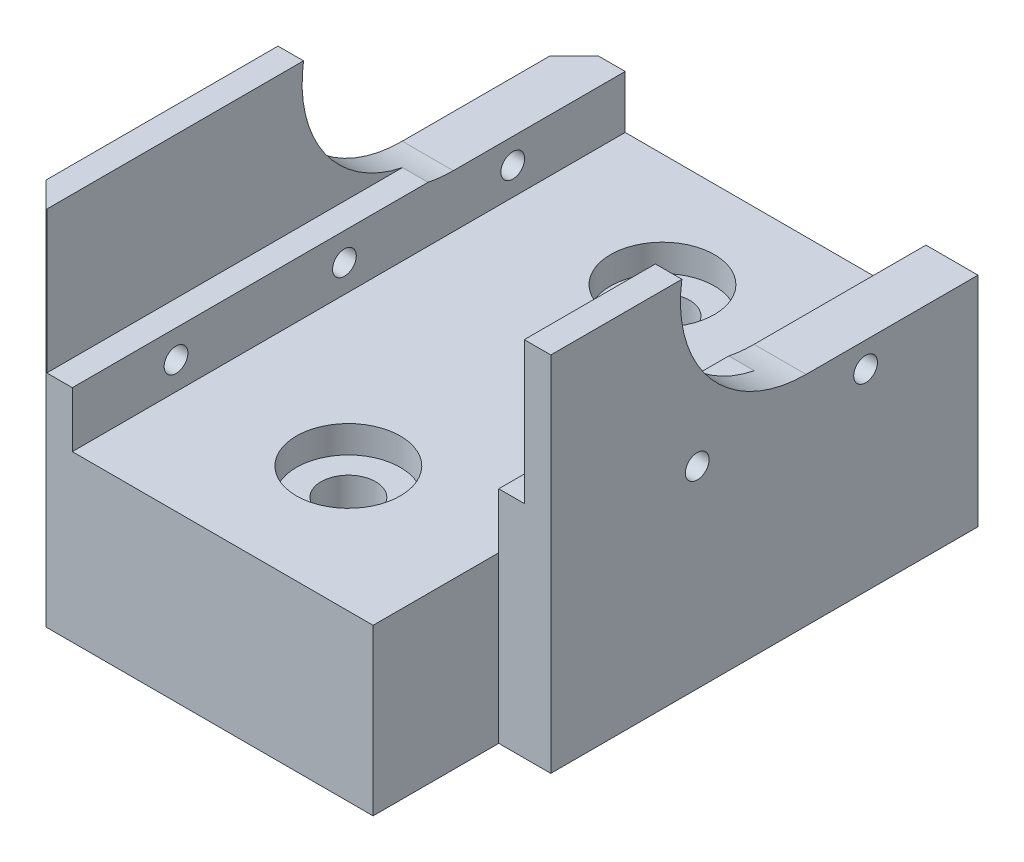
from build123d import *

# Parameters (mm, degrees)
SKETCH1_W                       = 45.72
SKETCH1_H                       = 60.96
BOSS_EXTRUDE1_DEPTH             = 6.35
SKETCH2_W                       = 7.6600046
SKETCH2_H                       = 60.96
BOSS_EXTRUDE2_DEPTH             = 20.955
LPATTERN1_COUNT                 = 3
LPATTERN1_PITCH                 = 17.018
SKETCH1_3_W                     = 45.72
SKETCH1_3_H                     = 60.96
BOSS_EXTRUDE3_DEPTH             = 2.54
CUT_EXTRUDE1_START              = 15.199995
SKETCH11_W                      = 60.96
SKETCH11_H                      = 14.3449802
CUT_EXTRUDE1_DEPTH              = 17.78
CUT_EXTRUDE2_DEPTH              = 62.358877312
SKETCH17_W                      = 45.72
SKETCH17_H                      = 60.96
BOSS_EXTRUDE4_DEPTH             = 6.785
SKETCH19_W                      = 30.3999908
SKETCH19_H                      = 60.96
BOSS_EXTRUDE5_DEPTH             = 1.0100056
CBORE_FOR_M5_SBHCS2_D           = 5.5
CBORE_FOR_M5_SBHCS2_CBORE_D     = 10.5
CBORE_FOR_M5_SBHCS2_CBORE_DEPTH = 2.75
CUT_EXTRUDE3_DEPTH              = 82.222264916
CUT_EXTRUDE3_DEPTH_BACK         = 82.222264916
SKETCH24_W                      = 5.08
SKETCH24_H                      = 45.72
SKETCH25_W                      = 7.6600046
SKETCH25_H                      = 36.63
CUT_EXTRUDE4_DEPTH              = 12.7
SKETCH26_W                      = 2.400000026
SKETCH26_H                      = 36.63
CUT_EXTRUDE5_DEPTH              = 67.262485805
SKETCH27_W                      = 2.5
SKETCH27_H                      = 36.63
CUT_EXTRUDE6_DEPTH              = 67.262485805
CHAMFER1_SIZE                   = 2.5


with BuildPart() as part:
    # Sketch1 → Boss-Extrude1 (new body)
    with BuildSketch(Plane(origin=(0, 0, 0), x_dir=(1, 0, 0), z_dir=(0, 1, 0))):
        Rectangle(SKETCH1_W, SKETCH1_H)
    extrude(amount=BOSS_EXTRUDE1_DEPTH)

    # Sketch2 → Boss-Extrude2 (add)
    with BuildSketch(Plane(origin=(0, 6.35, 0), x_dir=(1, 0, 0), z_dir=(0, 1, 0))):
        with Locations((-19.0299977, 0)):
            Rectangle(SKETCH2_W, SKETCH2_H)
        with Locations((19.0299977, 0)):
            Rectangle(SKETCH2_W, SKETCH2_H)
    extrude(amount=BOSS_EXTRUDE2_DEPTH)

    # Sketch7 → M2 Clearance Hole2 (revolve, cut)
    with BuildSketch(Plane(origin=(22.86, 10.16, 14.9171914), x_dir=(0, 0, -1), z_dir=(0, 1, 0))):
        Polygon((0, 0), (0, 46.441032743), (1.2, 45.72), (1.2, 0), align=None)
    m2_clearance_hole2 = revolve(axis=Axis((29.21, 10.16, 14.9171914), (-1, 0, 0)), mode=Mode.SUBTRACT)

    # LPattern1: M2 Clearance Hole2 ×3
    with Locations(*[(0, 0, -i * LPATTERN1_PITCH) for i in range(1, LPATTERN1_COUNT)]):
        add(m2_clearance_hole2, mode=Mode.SUBTRACT)

    # Sketch1<3> → Boss-Extrude3 (add)
    with BuildSketch(Plane(origin=(0, 0, 0), x_dir=(1, 0, 0), z_dir=(0, 1, 0))):
        Rectangle(SKETCH1_3_W, SKETCH1_3_H)
    extrude(amount=-BOSS_EXTRUDE3_DEPTH)

    # Sketch11 → Cut-Extrude1 (cut, symmetric)
    with BuildSketch(Plane.ZY.offset(-15.1999954).offset(CUT_EXTRUDE1_START)):
        with Locations((0, 20.1325099)):
            Rectangle(SKETCH11_W, SKETCH11_H)
    extrude(amount=CUT_EXTRUDE1_DEPTH, both=True, mode=Mode.SUBTRACT)

    # Sketch12 → Cut-Extrude2 (cut, through all)
    with BuildSketch(Plane(origin=(22.86, 0, 0), x_dir=(0, 0, -1), z_dir=(1, 0, 0))):
        with BuildLine():
            Line((13.105000048, 12.7), (30.48, 12.7))
            Line((30.48, 12.7), (30.48, 27.305))
            Line((30.48, 27.305), (25.661312206, 27.305))
            ThreePointArc((25.661312206, 27.305), (3.474748234, 33.679387055), (13.105000048, 12.7))
        make_face()
    extrude(amount=-CUT_EXTRUDE2_DEPTH, mode=Mode.SUBTRACT)

    # Sketch17 → Boss-Extrude4 (add)
    with BuildSketch(Plane.XZ.offset(2.54)):
        Rectangle(SKETCH17_W, SKETCH17_H)
    extrude(amount=BOSS_EXTRUDE4_DEPTH)

    # Sketch19 → Boss-Extrude5 (add)
    with BuildSketch(Plane(origin=(0, 6.35, 0), x_dir=(1, 0, 0), z_dir=(0, 1, 0))):
        Rectangle(SKETCH19_W, SKETCH19_H)
    extrude(amount=BOSS_EXTRUDE5_DEPTH)

    # CBORE for M5 SBHCS2 (through all)
    with Locations(Plane(origin=(0, 7.3600056, 0), x_dir=(1, 0, 0), z_dir=(0, 1, 0))):
        with Locations((0, -12.7), (0, 19.05)):
            CounterBoreHole(CBORE_FOR_M5_SBHCS2_D / 2, CBORE_FOR_M5_SBHCS2_CBORE_D / 2, CBORE_FOR_M5_SBHCS2_CBORE_DEPTH)

    # Sketch24 → Cut-Extrude3 (cut, two sides: drawn at the far end of the back side and taken through both)
    with BuildSketch(Plane(origin=(31.571183672, -12.7, -14.6188086), x_dir=(0, 0, -1), z_dir=(0, 1, 0)).offset(-CUT_EXTRUDE3_DEPTH_BACK)):
        with Locations((-42.5588086, 31.571183672)):
            Rectangle(SKETCH24_W, SKETCH24_H)
    extrude(amount=CUT_EXTRUDE3_DEPTH + CUT_EXTRUDE3_DEPTH_BACK, mode=Mode.SUBTRACT)

    # Sketch25 → Cut-Extrude4 (cut)
    with BuildSketch(Plane.XY.offset(25.4)):
        with Locations((19.0299977, 8.99)):
            Rectangle(SKETCH25_W, SKETCH25_H)
    extrude(amount=-CUT_EXTRUDE4_DEPTH, mode=Mode.SUBTRACT)

    # Sketch26 → Cut-Extrude5 (cut, through all)
    with BuildSketch(Plane.XY.offset(25.4)):
        with Locations((21.659999987, 8.99)):
            Rectangle(SKETCH26_W, SKETCH26_H)
    extrude(amount=-CUT_EXTRUDE5_DEPTH, mode=Mode.SUBTRACT)

    # Sketch27 → Cut-Extrude6 (cut, through all)
    with BuildSketch(Plane.XY.offset(25.4)):
        with Locations((-21.61, 8.99)):
            Rectangle(SKETCH27_W, SKETCH27_H)
    extrude(amount=-CUT_EXTRUDE6_DEPTH, mode=Mode.SUBTRACT)

    # Chamfer1
    chamfer1_edges = [part.edges().sort_by_distance(p)[0] for p in [
        (-20.36, 1.6875, -30.48),
        (-20.36, 8.99, 25.4),
    ]]
    chamfer(chamfer1_edges, length=CHAMFER1_SIZE)


solid = part.part
